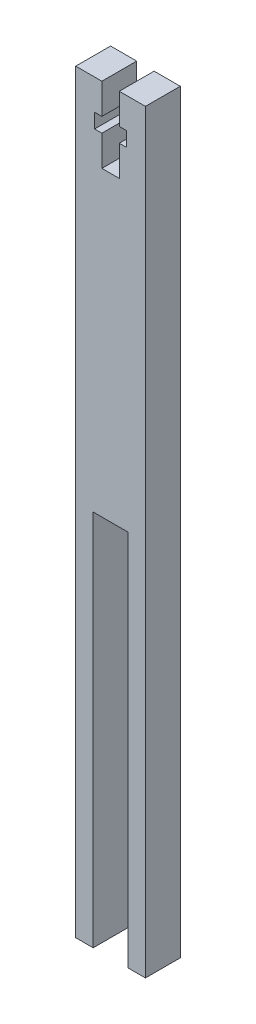
from build123d import *

# Parameters (mm, degrees)
EXTRUDE_1_DEPTH = 6


with BuildPart() as part:
    # Эскиз1 → Бобышка-Вытянуть1 (new body)
    with BuildSketch(Plane.XY):
        Polygon((-1.5, 130), (-1.5, 124.75), (-2.75, 124.75), (-2.75, 122.25), (-1.5, 122.25), (-1.5, 117), (1.5, 117), (1.5, 122.25), (2.75, 122.25), (2.75, 124.75), (1.5, 124.75), (1.5, 130), (6, 130), (6, 0), (3, 0), (3, 65), (-3, 65), (-3, 0), (-6, 0), (-6, 130), align=None)
    extrude(amount=EXTRUDE_1_DEPTH)


solid = part.part
